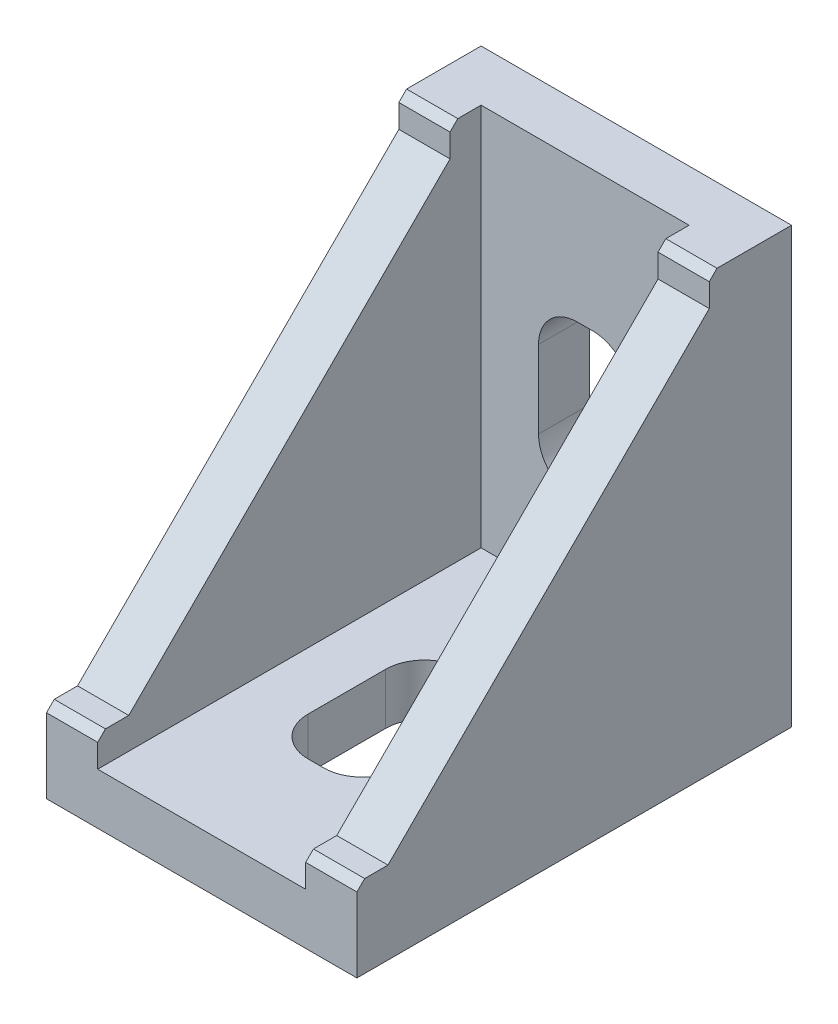
from build123d import *

# Parameters (mm, degrees)
SKETCH1_W           = 20
SKETCH1_H           = 28
BOSS_EXTRUDE1_DEPTH = 3.3
SKETCH2_W           = 20
SKETCH2_H           = 24.7
BOSS_EXTRUDE2_DEPTH = 3.3
BOSS_EXTRUDE3_DEPTH = 3.3
BOSS_EXTRUDE4_DEPTH = 3.3
CHAMFER1_SIZE       = 0.5
SKETCH5_W           = 4.3
SKETCH5_H           = 3
BOSS_EXTRUDE5_DEPTH = 1
SKETCH6_W           = 4.3
SKETCH6_H           = 3
BOSS_EXTRUDE6_DEPTH = 1


with BuildPart() as part:
    # Sketch1 → Boss-Extrude1 (new body)
    with BuildSketch(Plane.XY):
        with Locations((10, 14)):
            Rectangle(SKETCH1_W, SKETCH1_H)
        with BuildLine():
            Line((10.5, 9), (9.5, 9))
            ThreePointArc((9.5, 9), (7.732233047, 9.732233047), (7, 11.5))
            Line((7, 11.5), (7, 16.5))
            ThreePointArc((7, 16.5), (7.732233047, 18.267766953), (9.5, 19))
            Line((9.5, 19), (10.5, 19))
            ThreePointArc((10.5, 19), (12.267766953, 18.267766953), (13, 16.5))
            Line((13, 16.5), (13, 11.5))
            ThreePointArc((13, 11.5), (12.267766953, 9.732233047), (10.5, 9))
        make_face(mode=Mode.SUBTRACT)
    extrude(amount=-BOSS_EXTRUDE1_DEPTH)

    # Sketch2 → Boss-Extrude2 (add)
    with BuildSketch(Plane(origin=(0, 0, 0), x_dir=(1, 0, 0), z_dir=(0, 1, 0))):
        with Locations((10, -12.35)):
            Rectangle(SKETCH2_W, SKETCH2_H)
        with BuildLine():
            Line((10.5, -17.35), (9.5, -17.35))
            ThreePointArc((9.5, -17.35), (7.732233047, -16.617766953), (7, -14.85))
            Line((7, -14.85), (7, -9.85))
            ThreePointArc((7, -9.85), (7.732233047, -8.082233047), (9.5, -7.35))
            Line((9.5, -7.35), (10.5, -7.35))
            ThreePointArc((10.5, -7.35), (12.267766953, -8.082233047), (13, -9.85))
            Line((13, -9.85), (13, -14.85))
            ThreePointArc((13, -14.85), (12.267766953, -16.617766953), (10.5, -17.35))
        make_face(mode=Mode.SUBTRACT)
    extrude(amount=BOSS_EXTRUDE2_DEPTH)

    # Sketch3 → Boss-Extrude3 (add)
    with BuildSketch(Plane(origin=(0, 0, 0), x_dir=(0, 0, -1), z_dir=(1, 0, 0))):
        Polygon((0, 28), (-2, 28), (-2, 26), (-22.7, 5.3), (-24.7, 5.3), (-24.7, 3.3), (0, 3.3), align=None)
    extrude(amount=BOSS_EXTRUDE3_DEPTH)

    # Sketch4 → Boss-Extrude4 (add)
    with BuildSketch(Plane(origin=(20, 0, 0), x_dir=(0, 0, -1), z_dir=(1, 0, 0))):
        Polygon((0, 28), (-2, 28), (-2, 26), (-22.7, 5.3), (-24.7, 5.3), (-24.7, 3.3), (0, 3.3), align=None)
    extrude(amount=-BOSS_EXTRUDE4_DEPTH)

    # Chamfer1
    chamfer1_edges = [part.edges().sort_by_distance(p)[0] for p in [
        (1.65, 28, 2),
        (1.65, 5.3, 24.7),
        (18.35, 5.3, 24.7),
        (18.35, 28, 2),
    ]]
    chamfer(chamfer1_edges, length=CHAMFER1_SIZE)

    # Sketch5 → Boss-Extrude5 (add)
    with BuildSketch(Plane(origin=(0, 0, -3.3), x_dir=(-1, 0, 0), z_dir=(0, 0, -1))):
        with Locations((-10, 23.5)):
            Rectangle(SKETCH5_W, SKETCH5_H)
        with Locations((-10, 4.5)):
            Rectangle(SKETCH5_W, SKETCH5_H)
    extrude(amount=BOSS_EXTRUDE5_DEPTH)

    # Sketch6 → Boss-Extrude6 (add)
    with BuildSketch(Plane.XZ):
        with Locations((10, 1.2)):
            Rectangle(SKETCH6_W, SKETCH6_H)
        with Locations((10, 20.2)):
            Rectangle(SKETCH6_W, SKETCH6_H)
    extrude(amount=BOSS_EXTRUDE6_DEPTH)


solid = part.part
